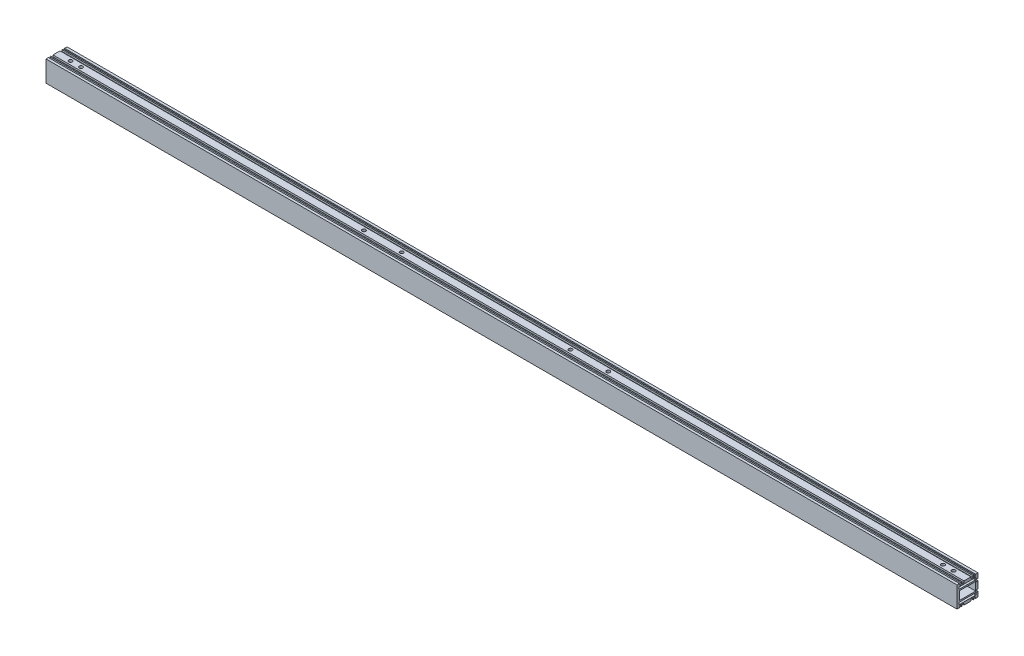
from build123d import *

# Parameters (mm, degrees)
SKETCH_1_W             = 23.5
SKETCH_1_H             = 12
EXTRUDE_1_DEPTH        = 650.5
HOLE_WIZARD_M6_1_D     = 5
HOLE_WIZARD_M6_1_DEPTH = 19
HOLE_WIZARD_M6_1_TIP   = 1.502151548
HOLE_WIZARD_M6_2_D     = 5
HOLE_WIZARD_M6_2_DEPTH = 19
HOLE_WIZARD_M6_2_TIP   = 1.502151548
HOLE_WIZARD_M4_1_D     = 3.3
HOLE_WIZARD_M4_1_DEPTH = 11.5
HOLE_WIZARD_M4_1_TIP   = 0.991420021


with BuildPart() as part:
    # 草图1 → 凸台-拉伸1 (new, symmetric)
    with BuildSketch(Plane(origin=(0, 0, 0), x_dir=(0, 0, -1), z_dir=(1, 0, 0))):
        Polygon((-15, 15), (-11.5, 15), (-11.5, 13.5), (-11, 13.5), (-11, 12), (-9.5, 12), (-9.5, 15), (-8, 15), (-8, 12.5), (-5, 12.5), (-5, 15), (5, 15), (5, 12.5), (8, 12.5), (8, 15), (9.5, 15), (9.5, 12), (11, 12), (11, 13.5), (11.5, 13.5), (11.5, 15), (15, 15), (15, 8), (12.5, 8), (12.5, 5), (15, 5), (15, -5), (12.5, -5), (12.5, -8), (15, -8), (15, -15), (11.5, -15), (11.5, -13.5), (11, -13.5), (11, -12), (9.5, -12), (9.5, -15), (8, -15), (8, -12.5), (5, -12.5), (5, -15), (-5, -15), (-5, -12.5), (-8, -12.5), (-8, -15), (-9.5, -15), (-9.5, -12), (-11, -12), (-11, -13.5), (-11.5, -13.5), (-11.5, -15), (-15, -15), align=None)
        with BuildLine():
            Line((12, -10.5), (12, -8.5))
            ThreePointArc((12, -8.5), (11.853553391, -8.146446609), (11.5, -8))
            Line((11.5, -8), (-11.5, -8))
            ThreePointArc((-11.5, -8), (-11.853553391, -8.146446609), (-12, -8.5))
            Line((-12, -8.5), (-12, -10.5))
            ThreePointArc((-12, -10.5), (-11.853553391, -10.853553391), (-11.5, -11))
            Line((-11.5, -11), (11.5, -11))
            ThreePointArc((11.5, -11), (11.853553391, -10.853553391), (12, -10.5))
        make_face(mode=Mode.SUBTRACT)
        with BuildLine():
            Line((-11.5, 11), (11.5, 11))
            ThreePointArc((11.5, 11), (11.853553391, 10.853553391), (12, 10.5))
            Line((12, 10.5), (12, 8.5))
            ThreePointArc((12, 8.5), (11.853553391, 8.146446609), (11.5, 8))
            Line((11.5, 8), (-11.5, 8))
            ThreePointArc((-11.5, 8), (-11.853553391, 8.146446609), (-12, 8.5))
            Line((-12, 8.5), (-12, 10.5))
            ThreePointArc((-12, 10.5), (-11.853553391, 10.853553391), (-11.5, 11))
        make_face(mode=Mode.SUBTRACT)
        Rectangle(SKETCH_1_W, SKETCH_1_H, mode=Mode.SUBTRACT)
    extrude(amount=EXTRUDE_1_DEPTH, both=True)

    # M6 螺纹孔1
    with Locations(Plane(origin=(0, 15, 0), x_dir=(1, 0, 0), z_dir=(0, 1, 0))):
        with Locations((-630.5, 0), (-615.5, 0), (615.5, 0), (630.5, 0), (-211.5, 0), (-157.5, 0), (83.5, 0), (137.5, 0)):
            Hole(HOLE_WIZARD_M6_1_D / 2, depth=HOLE_WIZARD_M6_1_DEPTH)
            with Locations((0, 0, -(HOLE_WIZARD_M6_1_DEPTH + HOLE_WIZARD_M6_1_TIP / 2))):  # 118° drill point
                Cone(0, HOLE_WIZARD_M6_1_D / 2, HOLE_WIZARD_M6_1_TIP, mode=Mode.SUBTRACT)

    # M6 螺纹孔2
    with Locations(Plane(origin=(0, 0, -15), x_dir=(-1, 0, 0), z_dir=(0, 0, -1))):
        with Locations((133.5, 0), (-6.5, 0)):
            Hole(HOLE_WIZARD_M6_2_D / 2, depth=HOLE_WIZARD_M6_2_DEPTH)
            with Locations((0, 0, -(HOLE_WIZARD_M6_2_DEPTH + HOLE_WIZARD_M6_2_TIP / 2))):  # 118° drill point
                Cone(0, HOLE_WIZARD_M6_2_D / 2, HOLE_WIZARD_M6_2_TIP, mode=Mode.SUBTRACT)

    # M4 螺纹孔1
    with Locations(Plane(origin=(0, 0, -15), x_dir=(-1, 0, 0), z_dir=(0, 0, -1))):
        with Locations((-312, 0)):
            Hole(HOLE_WIZARD_M4_1_D / 2, depth=HOLE_WIZARD_M4_1_DEPTH)
            with Locations((0, 0, -(HOLE_WIZARD_M4_1_DEPTH + HOLE_WIZARD_M4_1_TIP / 2))):  # 118° drill point
                Cone(0, HOLE_WIZARD_M4_1_D / 2, HOLE_WIZARD_M4_1_TIP, mode=Mode.SUBTRACT)


solid = part.part
